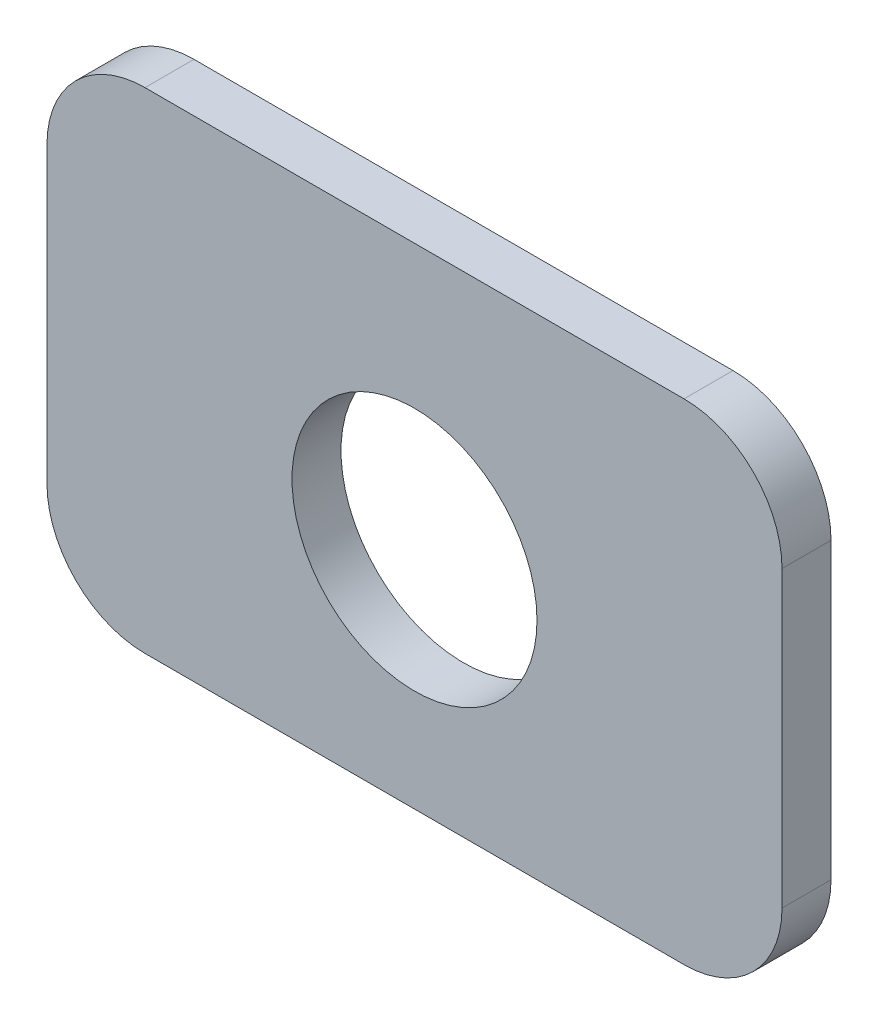
from build123d import *

# Parameters (mm, degrees)
SKETCH1_R           = 2.5
BOSS_EXTRUDE1_DEPTH = 1


with BuildPart() as part:
    # Sketch1 → Boss-Extrude1 (new body)
    with BuildSketch(Plane.XY):
        with BuildLine():
            Line((-5.5, 5), (5.5, 5))
            ThreePointArc((5.5, 5), (6.914213562, 4.414213562), (7.5, 3))
            Line((7.5, 3), (7.5, -3))
            ThreePointArc((7.5, -3), (6.914213562, -4.414213562), (5.5, -5))
            Line((5.5, -5), (-5.5, -5))
            ThreePointArc((-5.5, -5), (-6.914213562, -4.414213562), (-7.5, -3))
            Line((-7.5, -3), (-7.5, 3))
            ThreePointArc((-7.5, 3), (-6.914213562, 4.414213562), (-5.5, 5))
        make_face()
        with Locations((0, -0.415981234)):
            Circle(SKETCH1_R, mode=Mode.SUBTRACT)
    extrude(amount=BOSS_EXTRUDE1_DEPTH)


solid = part.part
